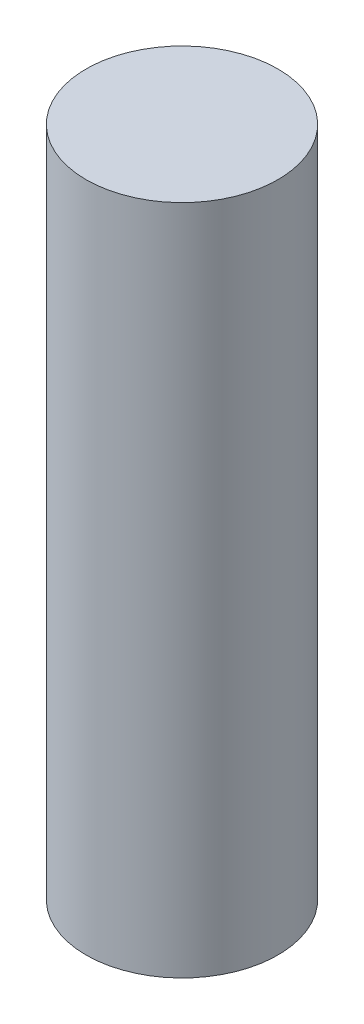
from build123d import *

# Parameters (mm, degrees)
SKETCH_1_R      = 5
EXTRUDE_1_DEPTH = 35


with BuildPart() as part:
    # 스케치1 → 보스-돌출1 (new body)
    with BuildSketch(Plane(origin=(0, 0, 0), x_dir=(1, 0, 0), z_dir=(0, 1, 0))):
        with Locations(Location((0, 0, 0), (0, 0, 270))):
            Circle(SKETCH_1_R)
    extrude(amount=EXTRUDE_1_DEPTH)


solid = part.part
